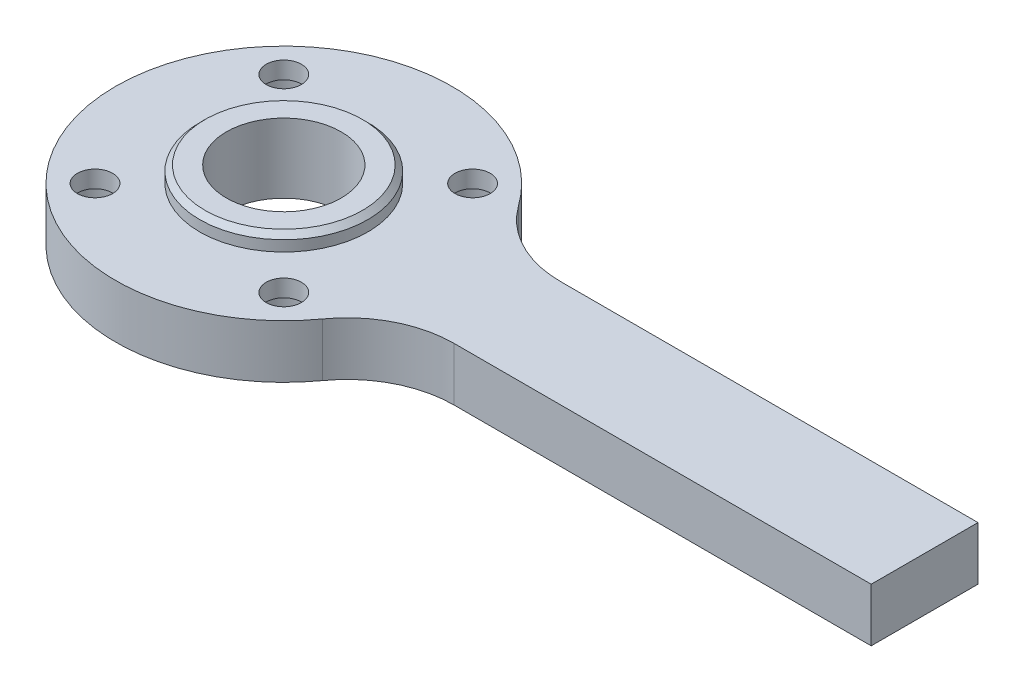
from build123d import *

# Parameters (mm, degrees)
SKETCH_2_R          = 31.5
EXTRUDE_1_DEPTH     = 10
SKETCH_3_R          = 15.75
EXTRUDE_2_DEPTH     = 3
SKETCH_5_R          = 3.3
CUT_EXTRUDE_2_DEPTH = 47.405818601
SKETCH_5_3_R        = 5.5
CUT_EXTRUDE_3_DEPTH = 6.8
SKETCH_6_W          = 20
SKETCH_6_H          = 10
EXTRUDE_3_DEPTH     = 120
SKETCH_4_R          = 10.75
CUT_EXTRUDE_4_DEPTH = 125.744739368
CHAMFER_1_SIZE      = 1
FILLET_1_R          = 20
FILLET_2_R          = 20


with BuildPart() as part:
    # 草图2 → 凸台-拉伸1 (new body)
    with BuildSketch(Plane(origin=(0, 0, 0), x_dir=(1, 0, 0), z_dir=(0, 1, 0))):
        Circle(SKETCH_2_R)
    extrude(amount=EXTRUDE_1_DEPTH)

    # 草图3 → 凸台-拉伸2 (add)
    with BuildSketch(Plane(origin=(0, 10, 0), x_dir=(1, 0, 0), z_dir=(0, 1, 0))):
        Circle(SKETCH_3_R)
    extrude(amount=EXTRUDE_2_DEPTH)

    # 草图5 → 切除-拉伸2 (cut, through all)
    with BuildSketch(Plane.XZ):
        with Locations((17.67766953, 17.67766953)):
            Circle(SKETCH_5_R)
        with Locations((-17.67766953, 17.67766953)):
            Circle(SKETCH_5_R)
        with Locations((-17.67766953, -17.67766953)):
            Circle(SKETCH_5_R)
        with Locations((17.67766953, -17.67766953)):
            Circle(SKETCH_5_R)
    extrude(amount=-CUT_EXTRUDE_2_DEPTH, mode=Mode.SUBTRACT)

    # 草图5<3> → 切除-拉伸3 (cut)
    with BuildSketch(Plane.XZ):
        with Locations((17.67766953, 17.67766953)):
            Circle(SKETCH_5_3_R)
        with Locations((-17.67766953, 17.67766953)):
            Circle(SKETCH_5_3_R)
        with Locations((-17.67766953, -17.67766953)):
            Circle(SKETCH_5_3_R)
        with Locations((17.67766953, -17.67766953)):
            Circle(SKETCH_5_3_R)
    extrude(amount=-CUT_EXTRUDE_3_DEPTH, mode=Mode.SUBTRACT)

    # 草图6 → 凸台-拉伸3 (add)
    with BuildSketch(Plane(origin=(0, 0, 0), x_dir=(0, 0, -1), z_dir=(1, 0, 0))):
        with Locations((0, 5)):
            Rectangle(SKETCH_6_W, SKETCH_6_H)
    extrude(amount=EXTRUDE_3_DEPTH)

    # 草图4 → 切除-拉伸4 (cut, through all)
    with BuildSketch(Plane(origin=(0, 0, 0), x_dir=(-1, 0, 0), z_dir=(0, -1, 0))):
        Circle(SKETCH_4_R)
    extrude(amount=-CUT_EXTRUDE_4_DEPTH, mode=Mode.SUBTRACT)

    # 倒角1
    chamfer_1_edges = [part.edges().sort_by_distance(p)[0] for p in [
        (-15.75, 13, 0),
    ]]
    chamfer(chamfer_1_edges, length=CHAMFER_1_SIZE)

    # 圆角1
    fillet_1_edges = [part.edges().sort_by_distance(p)[0] for p in [
        (29.870554062, 5, -10),
    ]]
    fillet(fillet_1_edges, radius=FILLET_1_R)

    # 圆角2
    fillet_2_edges = [part.edges().sort_by_distance(p)[0] for p in [
        (29.870554062, 5, 10),
    ]]
    fillet(fillet_2_edges, radius=FILLET_2_R)


solid = part.part
